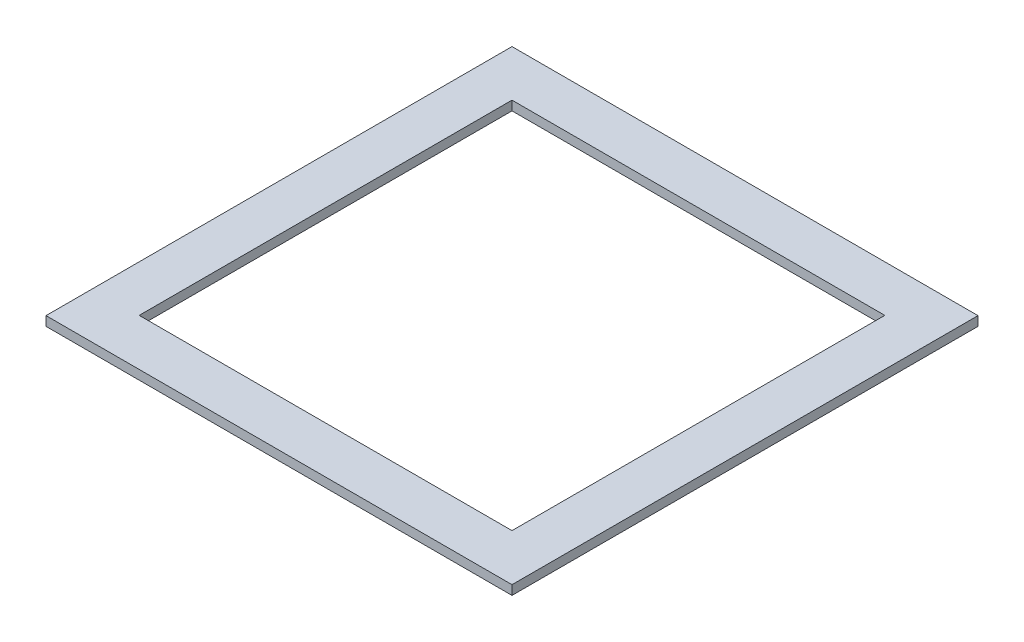
from build123d import *

# Parameters (mm, degrees)
SKETCH1_W           = 100
SKETCH1_H           = 100
SKETCH1_W_2         = 80
SKETCH1_H_2         = 80
BOSS_EXTRUDE1_DEPTH = 2


with BuildPart() as part:
    # Sketch1 → Boss-Extrude1 (new body)
    with BuildSketch(Plane(origin=(0, 0, 0), x_dir=(1, 0, 0), z_dir=(0, 1, 0))):
        with Locations((50, 50)):
            Rectangle(SKETCH1_W, SKETCH1_H)
        with Locations((49.953133131, 50.046866869)):
            Rectangle(SKETCH1_W_2, SKETCH1_H_2, mode=Mode.SUBTRACT)
    extrude(amount=BOSS_EXTRUDE1_DEPTH)


solid = part.part
